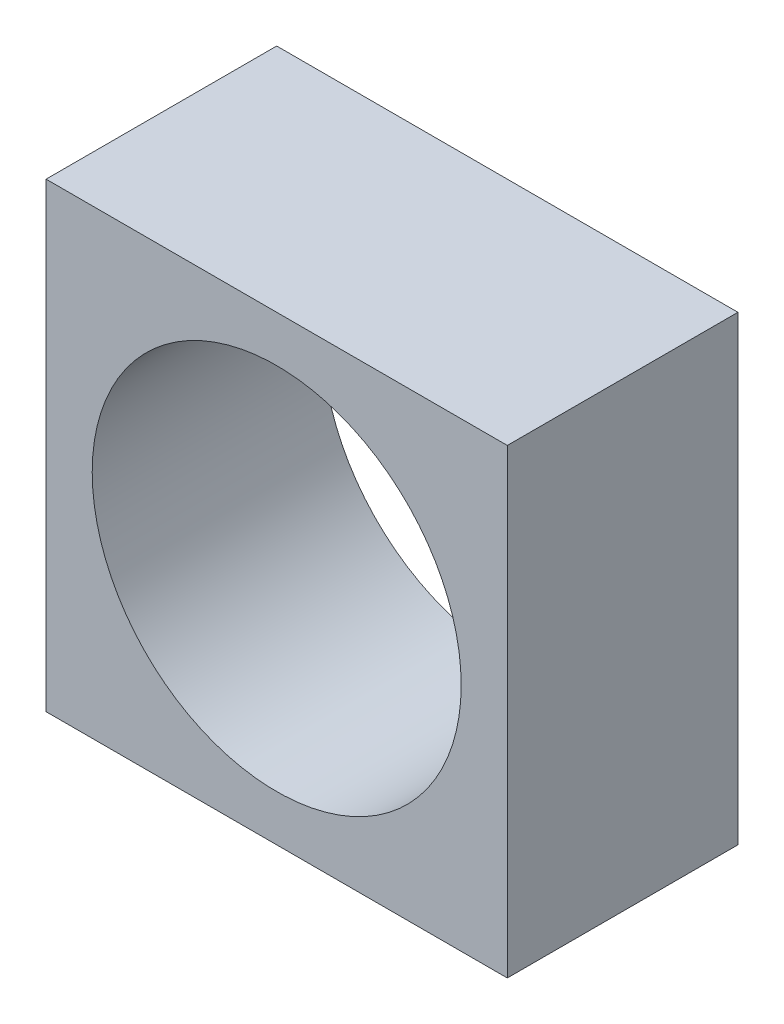
from build123d import *

# Parameters (mm, degrees)
CUT_EXTRUDE1_DEPTH      = 18.320508249
CUT_EXTRUDE1_DEPTH_BACK = 18.320508249
SKETCH3_R               = 8


with BuildPart() as part:
    # Sketch1 → Loft1 section 0
    with BuildSketch(Plane.XY):
        with BuildLine():
            Line((10, 10), (-10, 10))
            Line((-10, 10), (-10, -10))
            Line((-10, -10), (10, -10))
            Line((10, -10), (10, 10))
        make_face()
    # Sketch2 → Loft1 section 1
    with BuildSketch(Plane.XY.offset(10)):
        with BuildLine():
            Line((10, 10), (-10, 10))
            Line((-10, 10), (-10, -10))
            Line((-10, -10), (10, -10))
            Line((10, -10), (10, 10))
        make_face()
    loft()

    # Sketch3 → Cut-Extrude1 (cut, two sides: drawn at the far end of the back side and taken through both)
    with BuildSketch(Plane.XY.offset(-CUT_EXTRUDE1_DEPTH_BACK)):
        with Locations(Location((0, 0, 0), (0, 0, 180))):
            Circle(SKETCH3_R)
    extrude(amount=CUT_EXTRUDE1_DEPTH + CUT_EXTRUDE1_DEPTH_BACK, mode=Mode.SUBTRACT)


solid = part.part
